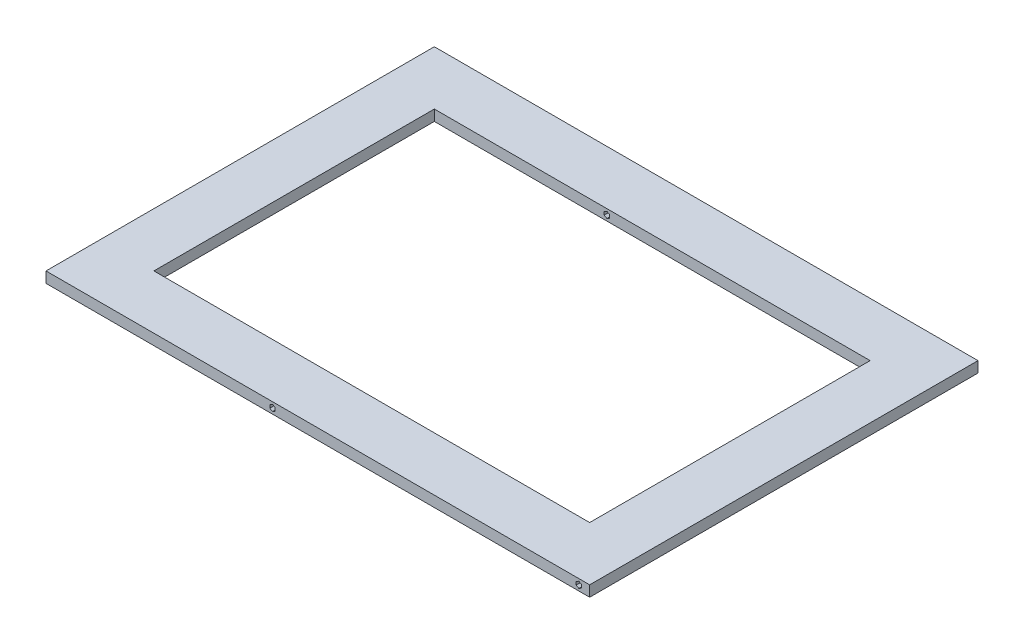
from build123d import *

# Parameters (mm, degrees)
BOSS_EXTRUDE1_DEPTH      = 90
BOSS_EXTRUDE1_DEPTH_BACK = 90
SKETCH1_W                = 252
SKETCH1_H                = 5
CUT_EXTRUDE1_DEPTH       = 220.732223399
SKETCH5_W                = 202
SKETCH5_H                = 130
CUT_EXTRUDE3_DEPTH       = 155.922561301


with BuildPart() as part:
    # Sketch1 → Boss-Extrude1 (new, two sides: drawn at the far end of the back side and taken through both)
    with BuildSketch(Plane.XY.offset(-BOSS_EXTRUDE1_DEPTH_BACK)):
        Rectangle(SKETCH1_W, SKETCH1_H)
    extrude(amount=BOSS_EXTRUDE1_DEPTH + BOSS_EXTRUDE1_DEPTH_BACK)

    # Sketch2 → Cut-Extrude1 (cut, through all)
    with BuildSketch(Plane.XY.offset(90)):
        Polygon((-21, 1.443375673), (-22.25, 0.721687836), (-22.25, -0.721687836), (-21, -1.443375673), (-19.75, -0.721687836), (-19.75, 0.721687836), align=None)
        Polygon((121, 1.443375673), (119.75, 0.721687836), (119.75, -0.721687836), (121, -1.443375673), (122.25, -0.721687836), (122.25, 0.721687836), align=None)
    extrude(amount=-CUT_EXTRUDE1_DEPTH, mode=Mode.SUBTRACT)

    # Sketch5 → Cut-Extrude3 (cut, through all)
    with BuildSketch(Plane(origin=(0, 2.5, 0), x_dir=(1, 0, 0), z_dir=(0, 1, 0))):
        Rectangle(SKETCH5_W, SKETCH5_H)
    extrude(amount=-CUT_EXTRUDE3_DEPTH, mode=Mode.SUBTRACT)


solid = part.part
